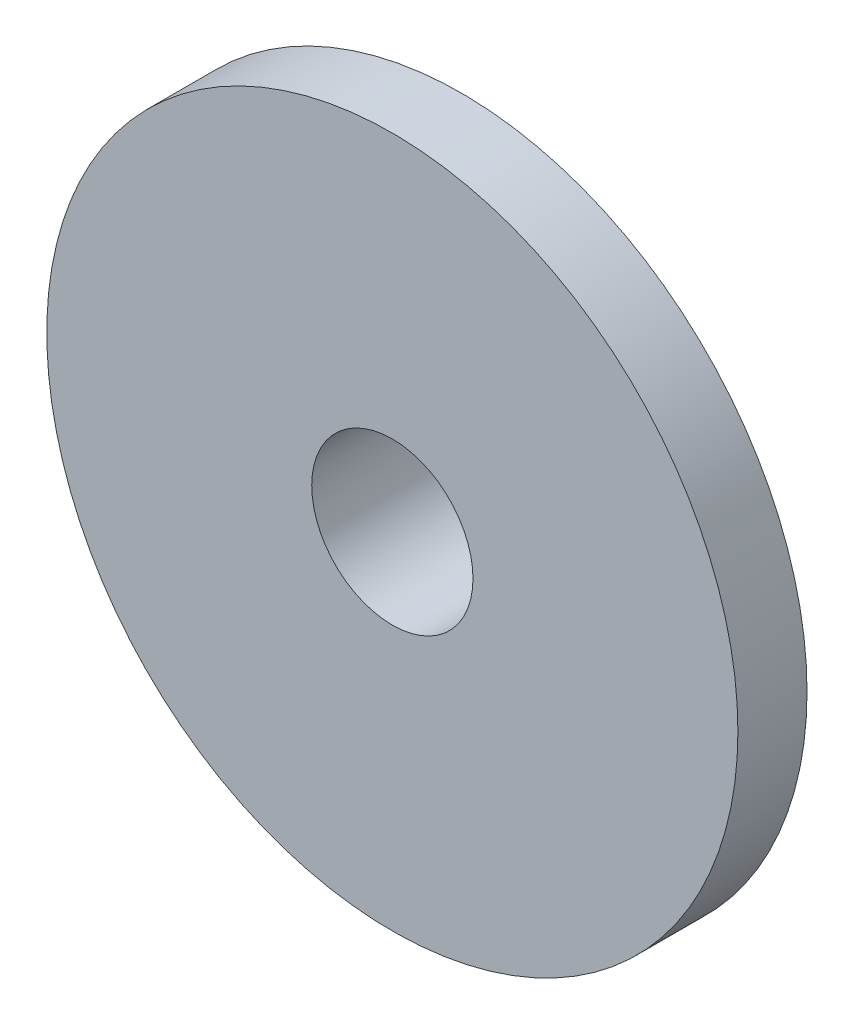
from build123d import *

# Parameters (mm, degrees)
SKETCH1_R           = 15
SKETCH1_R_2         = 4
BOSS_EXTRUDE1_DEPTH = 3
SKETCH2_R           = 4
SKETCH2_R_2         = 3.5
BOSS_EXTRUDE2_DEPTH = 5
SKETCH4_R           = 4
SKETCH4_R_2         = 3.5
BOSS_EXTRUDE4_DEPTH = 3


with BuildPart() as part:
    # Sketch1 → Boss-Extrude1 (new body)
    with BuildSketch(Plane.XY):
        with Locations((-0.860205172, 39.990749519)):
            Circle(SKETCH1_R)
        with Locations((-0.860205172, 39.990749519)):
            Circle(SKETCH1_R_2, mode=Mode.SUBTRACT)
    extrude(amount=BOSS_EXTRUDE1_DEPTH)



with BuildPart() as body_2:
    # Sketch2 → Boss-Extrude2 (new body)
    with BuildSketch(Plane(origin=(0, 0, 0), x_dir=(-1, 0, 0), z_dir=(0, 0, -1))):
        with Locations(Location((0.860205172, 39.990749519, 0), (0, 0, 180))):
            Circle(SKETCH2_R)
        with Locations((0.860205172, 39.990749519)):
            Circle(SKETCH2_R_2, mode=Mode.SUBTRACT)
    extrude(amount=BOSS_EXTRUDE2_DEPTH)


with BuildPart() as part_1:
    add(part.part)

    add(body_2.part)  # Boss-Extrude4 merges body 2
    # Sketch4 → Boss-Extrude4 (add)
    with BuildSketch(Plane.XY):
        with Locations((-0.860205172, 39.990749519)):
            Circle(SKETCH4_R)
        with Locations(Location((-0.860205172, 39.990749519, 0), (0, 0, 180))):
            Circle(SKETCH4_R_2, mode=Mode.SUBTRACT)
    extrude(amount=BOSS_EXTRUDE4_DEPTH)


solid = part_1.part
